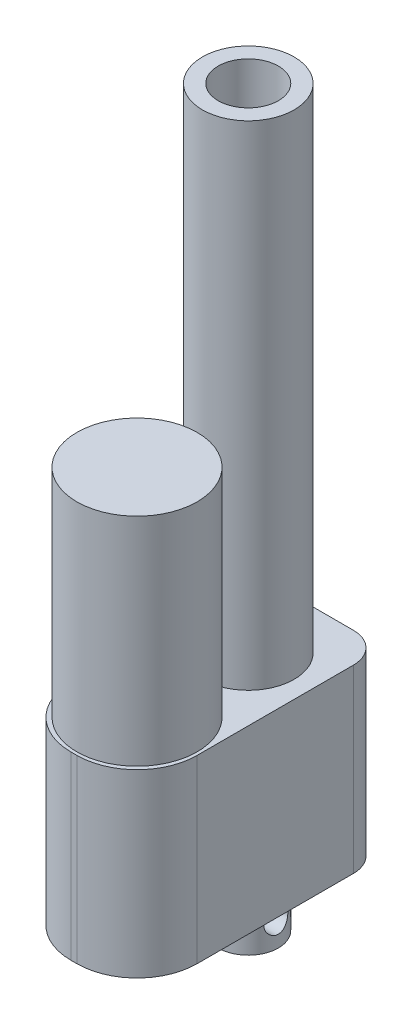
from build123d import *

# Parameters (mm, degrees)
SKETCH1_R      = 15.25
EXTRUDE1_DEPTH = 164
EXTRUDE2_DEPTH = 60
SKETCH3_R      = 20
EXTRUDE3_DEPTH = 72
SKETCH4_R      = 10
EXTRUDE4_DEPTH = 20
SKETCH5_R      = 4
EXTRUDE5_DEPTH = 15
SKETCH6_R      = 10
EXTRUDE6_DEPTH = 150
FILLET_1_R     = 10


with BuildPart() as part:
    # Sketch1 → Extrude1 (new body)
    with BuildSketch(Plane(origin=(0, 0, 0), x_dir=(1, 0, 0), z_dir=(0, 1, 0))):
        with Locations(Location((0, 0, 0), (0, 0, 270))):
            Circle(SKETCH1_R)
    extrude(amount=EXTRUDE1_DEPTH)

    # Sketch2 → Extrude2 (add)
    with BuildSketch(Plane.XZ):
        with BuildLine():
            Line((-1, 58), (1, 58))
            ThreePointArc((1, 58), (15.142135624, 52.142135624), (21, 38))
            Line((21, 38), (21, -24))
            Line((21, -24), (-21, -24))
            Line((-21, -24), (-21, 38))
            ThreePointArc((-21, 38), (-15.142135624, 52.142135624), (-1, 58))
        make_face()
    extrude(amount=EXTRUDE2_DEPTH)

    # Sketch3 → Extrude3 (add)
    with BuildSketch(Plane(origin=(0, 0, 0), x_dir=(1, 0, 0), z_dir=(0, 1, 0))):
        with Locations(Location((0, -37, 0), (0, 0, 90))):
            Circle(SKETCH3_R)
    extrude(amount=EXTRUDE3_DEPTH)

    # Sketch4 → Extrude4 (add)
    with BuildSketch(Plane.XZ.offset(60)):
        with Locations(Location((0, 0, 0), (0, 0, 270))):
            Circle(SKETCH4_R)
    extrude(amount=EXTRUDE4_DEPTH)

    # Sketch5 → Extrude5 (cut, symmetric)
    with BuildSketch(Plane(origin=(0, 0, 0), x_dir=(0, 0, -1), z_dir=(1, 0, 0))):
        with Locations((0, -72)):
            Circle(SKETCH5_R)
    extrude(amount=EXTRUDE5_DEPTH, both=True, mode=Mode.SUBTRACT)

    # Sketch6 → Extrude6 (cut)
    with BuildSketch(Plane(origin=(0, 164, 0), x_dir=(1, 0, 0), z_dir=(0, 1, 0))):
        with Locations(Location((0, 0, 0), (0, 0, 90))):
            Circle(SKETCH6_R)
    extrude(amount=-EXTRUDE6_DEPTH, mode=Mode.SUBTRACT)

    # Скругление1
    fillet_1_edges = [part.edges().sort_by_distance(p)[0] for p in [
        (21, -30, -24),
        (-21, -30, -24),
    ]]
    fillet(fillet_1_edges, radius=FILLET_1_R)


solid = part.part
